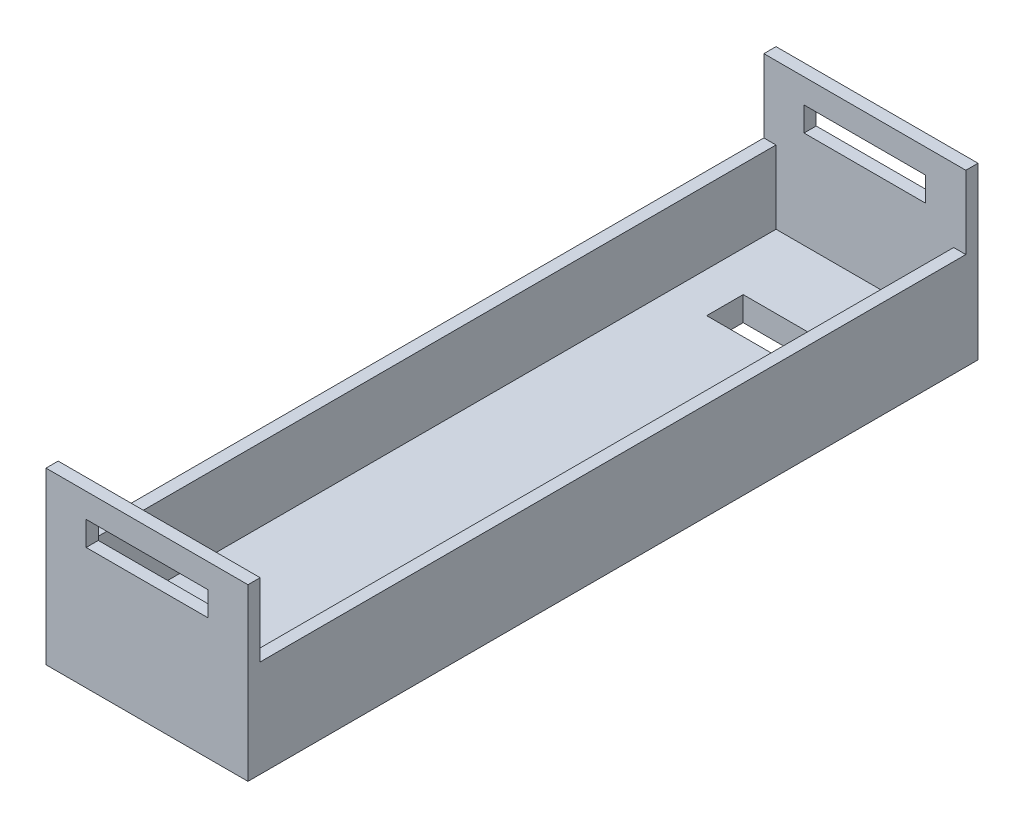
from build123d import *

# Parameters (mm, degrees)
SKETCH1_W           = 83
SKETCH1_H           = 70
BOSS_EXTRUDE1_DEPTH = 150
SKETCH2_W           = 73
SKETCH2_H           = 290
CUT_EXTRUDE1_DEPTH  = 60
SKETCH3_W           = 290
SKETCH3_H           = 30
CUT_EXTRUDE2_DEPTH  = 109
SKETCH4_W           = 50
SKETCH4_H           = 10
CUT_EXTRUDE3_DEPTH  = 343
SKETCH5_W           = 40
SKETCH5_H           = 15
CUT_EXTRUDE4_DEPTH  = 343


with BuildPart() as part:
    # Sketch1 → Boss-Extrude1 (new, symmetric)
    with BuildSketch(Plane.XY):
        Rectangle(SKETCH1_W, SKETCH1_H)
    extrude(amount=BOSS_EXTRUDE1_DEPTH, both=True)

    # Sketch2 → Cut-Extrude1 (cut)
    with BuildSketch(Plane(origin=(0, 35, 0), x_dir=(1, 0, 0), z_dir=(0, 1, 0))):
        Rectangle(SKETCH2_W, SKETCH2_H)
    extrude(amount=-CUT_EXTRUDE1_DEPTH, mode=Mode.SUBTRACT)

    # Sketch3 → Cut-Extrude2 (cut)
    with BuildSketch(Plane.ZY.offset(41.5)):
        with Locations((0, 20)):
            Rectangle(SKETCH3_W, SKETCH3_H)
    extrude(amount=-CUT_EXTRUDE2_DEPTH, mode=Mode.SUBTRACT)

    # Sketch4 → Cut-Extrude3 (cut)
    with BuildSketch(Plane.XY.offset(150)):
        with Locations((0, 20)):
            Rectangle(SKETCH4_W, SKETCH4_H)
    extrude(amount=-CUT_EXTRUDE3_DEPTH, mode=Mode.SUBTRACT)

    # Sketch5 → Cut-Extrude4 (cut)
    with BuildSketch(Plane(origin=(0, -25, 0), x_dir=(1, 0, 0), z_dir=(0, 1, 0))):
        with Locations((0, 107.5)):
            Rectangle(SKETCH5_W, SKETCH5_H)
    extrude(amount=-CUT_EXTRUDE4_DEPTH, mode=Mode.SUBTRACT)


solid = part.part
